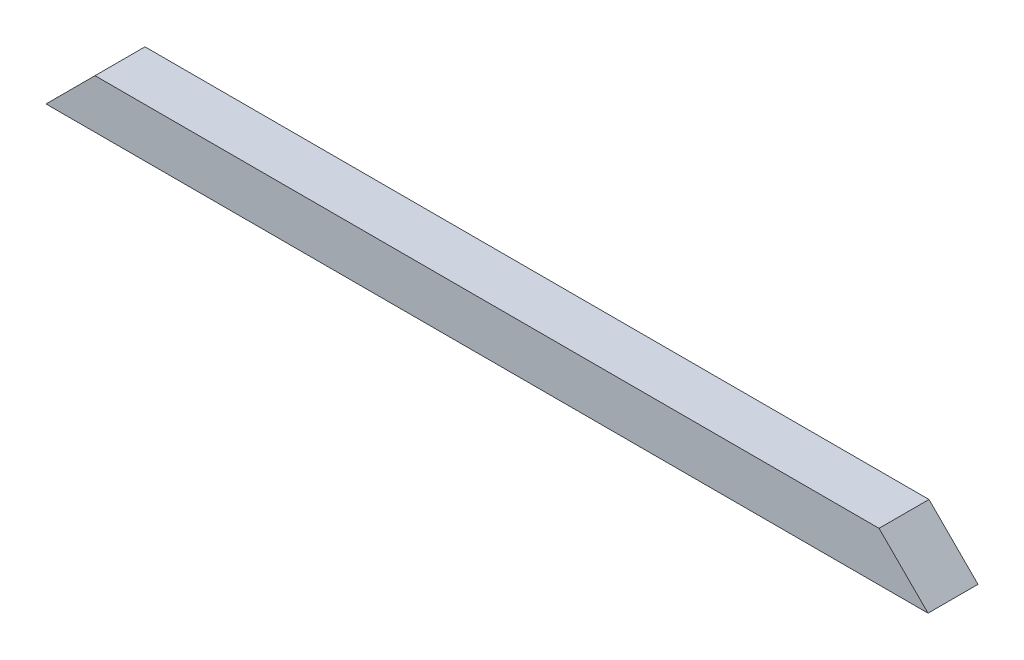
from build123d import *

# Parameters (mm, degrees)
SALIENTE_EXTRUIR1_DEPTH      = 50.8
SALIENTE_EXTRUIR1_DEPTH_BACK = 1
CROQUIS1_W                   = 914.4
CROQUIS1_H                   = 50.8
CORTAR_EXTRUIR2_DEPTH        = 461.825606927
CORTAR_EXTRUIR3_DEPTH        = 461.825606927
CORTAR_EXTRUIR4_DEPTH        = 461.825606927


with BuildPart() as part:
    # Croquis1 → Saliente-Extruir1 (new, two sides: drawn at the far end of the back side and taken through both)
    with BuildSketch(Plane.XY.offset(-SALIENTE_EXTRUIR1_DEPTH_BACK)):
        Rectangle(CROQUIS1_W, CROQUIS1_H)
    extrude(amount=SALIENTE_EXTRUIR1_DEPTH + SALIENTE_EXTRUIR1_DEPTH_BACK)

    # Croquis3 → Cortar-Extruir2 (cut, through all)
    with BuildSketch(Plane.XY.offset(50.8)):
        Polygon((-437.2, 25.4), (-457.2, 25.4), (-457.2, -25.4), align=None)
    extrude(amount=-CORTAR_EXTRUIR2_DEPTH, mode=Mode.SUBTRACT)

    # Croquis4 → Cortar-Extruir3 (cut, through all)
    with BuildSketch(Plane(origin=(0, 0, -1), x_dir=(-1, 0, 0), z_dir=(0, 0, -1))):
        Polygon((-437.2, 25.4), (-457.2, 25.4), (-457.2, -25.4), align=None)
    extrude(amount=-CORTAR_EXTRUIR3_DEPTH, mode=Mode.SUBTRACT)

    # Croquis6 → Cortar-Extruir4 (cut, through all)
    with BuildSketch(Plane.XY.offset(50.8)):
        Polygon((-437.2, 25.4), (-457.2, -25.4), (-406.4, 25.4), align=None)
        Polygon((437.2, 25.4), (406.4, 25.4), (457.2, -25.4), align=None)
    extrude(amount=-CORTAR_EXTRUIR4_DEPTH, mode=Mode.SUBTRACT)


solid = part.part
